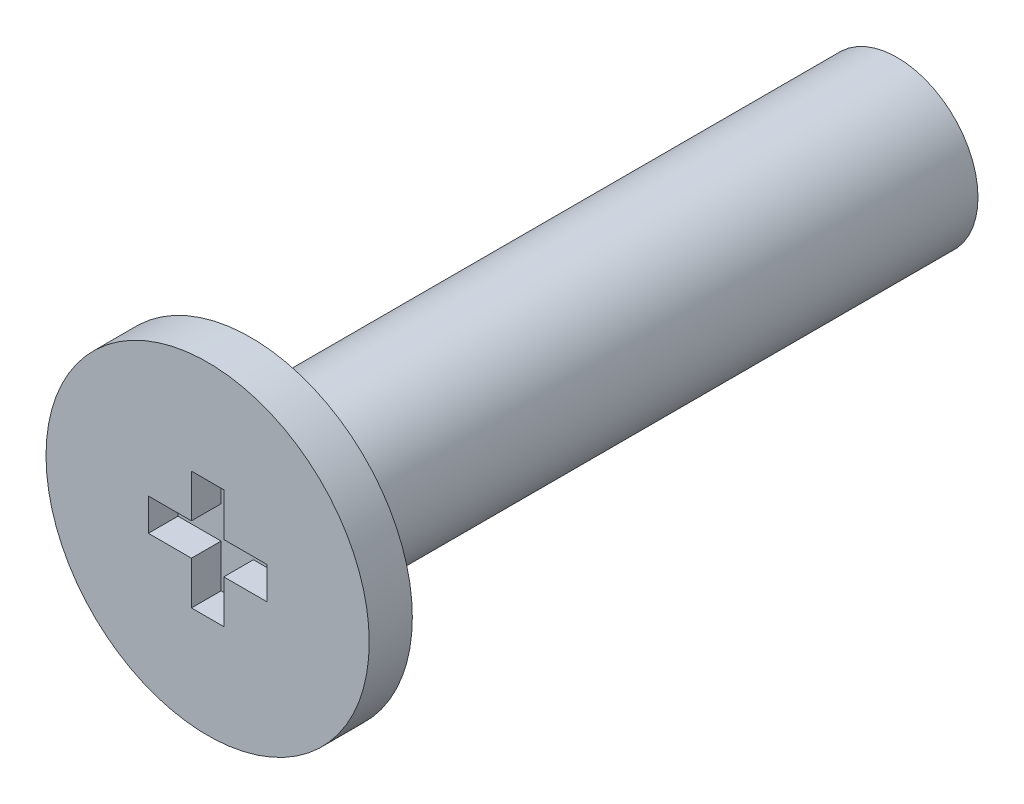
from build123d import *

# Parameters (mm, degrees)
SKETCH_1_R        = 1.5
EXTRUDE_198_DEPTH = 12
SKETCH_6_W        = 3
SKETCH_6_H        = 0.8
PH1_START         = 0.81
PH1_DEPTH         = 0.56


with BuildPart() as part:
    # 草图1 → Extrude 198 (new body)
    with BuildSketch(Plane.XY):
        Circle(SKETCH_1_R)
    extrude(amount=-EXTRUDE_198_DEPTH)

    # 草图6 → Revolve 324 (revolve)
    with BuildSketch(Plane(origin=(0, 0, 0), x_dir=(1, 0, 0), z_dir=(0, 1, 0)), mode=Mode.PRIVATE) as revolve_324_sk:
        with Locations((1.5, -0.4)):
            Rectangle(SKETCH_6_W, SKETCH_6_H)
    revolve(revolve_324_sk.sketch.rotate(Axis((0, 0, -2), (0, 0, 1)), 180), axis=Axis((0, 0, -2), (0, 0, 1)))

    # 草图7 → 十字槽_PH1_简化 (cut)
    with BuildSketch(Plane.XY.offset(PH1_START)):
        Polygon((-0.3, -1.1), (0.3, -1.1), (0.3, -0.3), (1.1, -0.3), (1.1, 0.3), (0.3, 0.3), (0.3, 1.1), (-0.3, 1.1), (-0.3, 0.3), (-1.1, 0.3), (-1.1, -0.3), (-0.3, -0.3), align=None)
    extrude(amount=-PH1_DEPTH, mode=Mode.SUBTRACT)


solid = part.part
